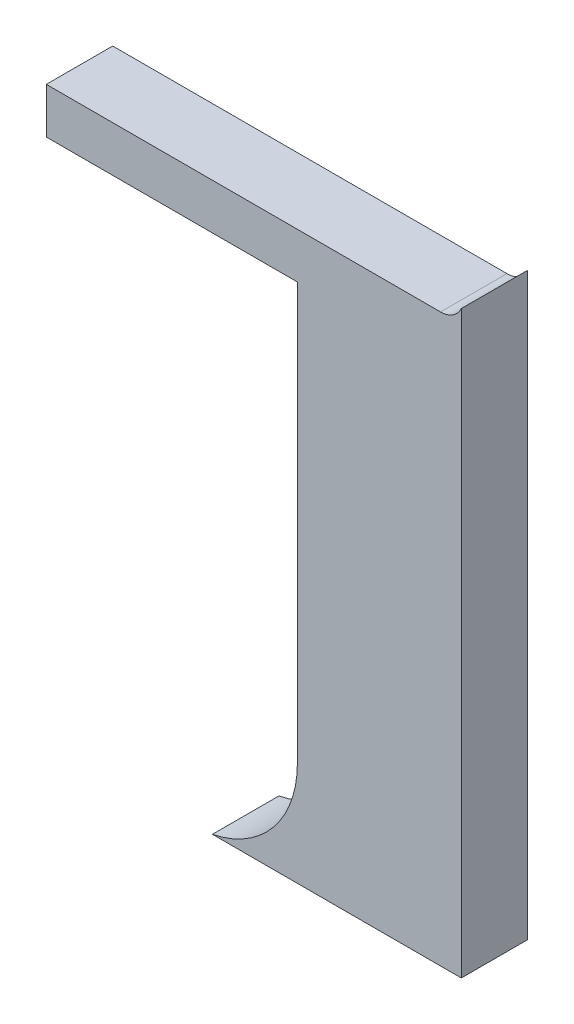
from build123d import *

# Parameters (mm, degrees)
ESTRUSIONE_ESTRUSIONE1_DEPTH = 6.4


with BuildPart() as part:
    # Schizzo1 → Estrusione-Estrusione1 (new body)
    with BuildSketch(Plane.XY):
        with BuildLine():
            Line((29, -3.2), (29, -7.6))
            Line((29, -7.6), (53.2, -7.6))
            Line((53.2, -7.6), (53.2, -47.8))
            ThreePointArc((53.2, -47.8), (50.891189589, -54.262903904), (45.009975124, -57.8))
            Line((45.009975124, -57.8), (69, -57.8))
            Line((69, -57.8), (69, -1.916515139))
            ThreePointArc((69, -1.916515139), (68.188205936, -2.851530894), (67, -3.2))
            Line((67, -3.2), (29, -3.2))
        make_face()
    extrude(amount=ESTRUSIONE_ESTRUSIONE1_DEPTH)


solid = part.part
